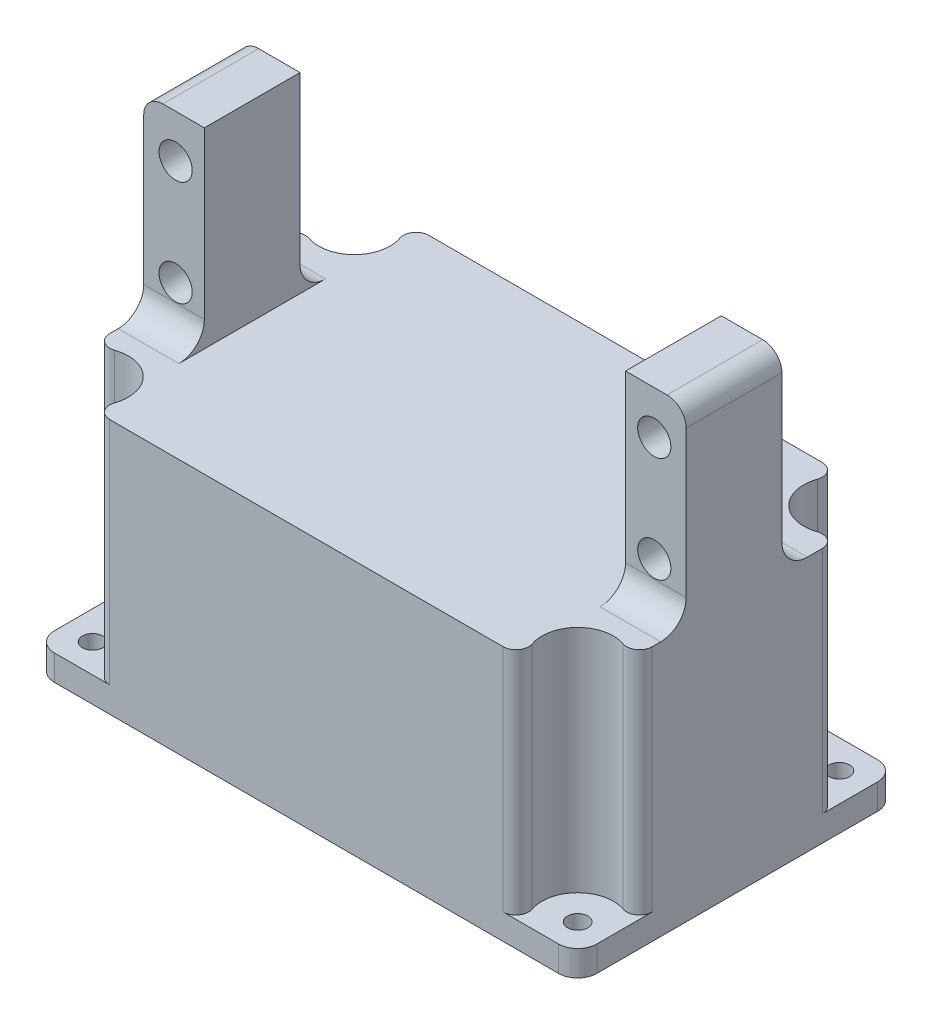
from build123d import *

# Parameters (mm, degrees)
EXTRUDE_1_DEPTH     = 40
SKETCH_2_W          = 9.5
SKETCH_2_H          = 30
EXTRUDE_2_DEPTH     = 15
SKETCH_3_R          = 2.6
CUT_EXTRUDE_1_DEPTH = 89.290712988
FILLET_1_R          = 3
FILLET_2_R          = 4
SKETCH_4_R          = 1.6
CUT_EXTRUDE_2_DEPTH = 64.492125496
CUT_EXTRUDE_3_DEPTH = 36
FILLET_3_R          = 2
SKETCH_7_R          = 5.6
CUT_EXTRUDE_4_DEPTH = 36
FILLET_4_R          = 2


with BuildPart() as part:
    # 草图1 → 凸台-拉伸1 (new body)
    with BuildSketch(Plane(origin=(0, 0, 0), x_dir=(1, 0, 0), z_dir=(0, 1, 0))):
        with BuildLine():
            Line((-39.5, -25), (39.5, -25))
            ThreePointArc((39.5, -25), (41.621320344, -24.121320344), (42.5, -22))
            Line((42.5, -22), (42.5, 22))
            ThreePointArc((42.5, 22), (41.621320344, 24.121320344), (39.5, 25))
            Line((39.5, 25), (-39.5, 25))
            ThreePointArc((-39.5, 25), (-41.621320344, 24.121320344), (-42.5, 22))
            Line((-42.5, 22), (-42.5, -22))
            ThreePointArc((-42.5, -22), (-41.621320344, -24.121320344), (-39.5, -25))
        make_face()
    extrude(amount=EXTRUDE_1_DEPTH)

    # 草图2 → 凸台-拉伸2 (add)
    with BuildSketch(Plane.XY.offset(-7)):
        with Locations((-37.75, 55)):
            Rectangle(SKETCH_2_W, SKETCH_2_H)
    extrude_2 = extrude(amount=EXTRUDE_2_DEPTH)

    # 镜向1: 凸台-拉伸2 across plane
    add(extrude_2.mirror(Plane(origin=(0, 0, 0), x_dir=(0, 0, 1), z_dir=(1, 0, 0))))

    # 草图3 → 切除-拉伸1 (cut, through all)
    with BuildSketch(Plane.XY.offset(8)):
        with Locations((37.5, 63.25)):
            Circle(SKETCH_3_R)
        with Locations((37.5, 46.75)):
            Circle(SKETCH_3_R)
        with Locations((-37.5, 63.25)):
            Circle(SKETCH_3_R)
        with Locations((-37.5, 46.75)):
            Circle(SKETCH_3_R)
    extrude(amount=-CUT_EXTRUDE_1_DEPTH, mode=Mode.SUBTRACT)

    # 圆角1
    fillet_1_edges = [part.edges().sort_by_distance(p)[0] for p in [
        (-42.5, 70, 0.5),
        (42.5, 70, 0.5),
    ]]
    fillet(fillet_1_edges, radius=FILLET_1_R)

    # 圆角2
    fillet_2_edges = [part.edges().sort_by_distance(p)[0] for p in [
        (-37.75, 40, -7),
        (-37.75, 40, 8),
        (37.75, 40, 8),
        (37.75, 40, -7),
    ]]
    fillet(fillet_2_edges, radius=FILLET_2_R)

    # 草图4 → 切除-拉伸2 (cut, through all)
    with BuildSketch(Plane(origin=(0, 40, 0), x_dir=(1, 0, 0), z_dir=(0, 1, 0))):
        with Locations(Location((-38, 20.5, 0), (0, 0, 270))):
            Circle(SKETCH_4_R)
        with Locations(Location((38, 20.5, 0), (0, 0, 270))):
            Circle(SKETCH_4_R)
        with Locations(Location((38, -20.5, 0), (0, 0, 270))):
            Circle(SKETCH_4_R)
        with Locations(Location((-38, -20.5, 0), (0, 0, 270))):
            Circle(SKETCH_4_R)
    extrude(amount=-CUT_EXTRUDE_2_DEPTH, mode=Mode.SUBTRACT)

    # 草图5 → 切除-拉伸3 (cut)
    with BuildSketch(Plane.XZ):
        with BuildLine():
            ThreePointArc((29.414547187, -20), (31.918881682, -14.418881682), (37.5, -11.914547187))
            Line((37.5, -11.914547187), (37.5, 11.914547187))
            ThreePointArc((37.5, 11.914547187), (31.918881682, 14.418881682), (29.414547187, 20))
            Line((29.414547187, 20), (-29.414547187, 20))
            ThreePointArc((-29.414547187, 20), (-31.918881682, 14.418881682), (-37.5, 11.914547187))
            Line((-37.5, 11.914547187), (-37.5, -11.914547187))
            ThreePointArc((-37.5, -11.914547187), (-31.918881682, -14.418881682), (-29.414547187, -20))
            Line((-29.414547187, -20), (29.414547187, -20))
        make_face()
    extrude(amount=-CUT_EXTRUDE_3_DEPTH, mode=Mode.SUBTRACT)

    # 圆角3
    fillet_3_edges = [part.edges().sort_by_distance(p)[0] for p in [
        (31.918881682, 36, -14.418881682),
        (-31.918881682, 36, -14.418881682),
        (-31.918881682, 36, 14.418881682),
        (31.918881682, 36, 14.418881682),
        (37.5, 36, 0),
        (37.5, 18, 11.914547187),
        (29.414547187, 18, 20),
        (0, 36, 20),
        (-29.414547187, 18, 20),
        (-37.5, 18, 11.914547187),
        (-37.5, 36, 0),
        (-37.5, 18, -11.914547187),
        (-29.414547187, 18, -20),
        (0, 36, -20),
        (29.414547187, 18, -20),
        (37.5, 18, -11.914547187),
    ]]
    fillet(fillet_3_edges, radius=FILLET_3_R)

    # 草图7 → 切除-拉伸4 (cut)
    with BuildSketch(Plane(origin=(0, 40, 0), x_dir=(1, 0, 0), z_dir=(0, 1, 0))):
        with Locations((-38, 20.5)):
            Circle(SKETCH_7_R)
        with Locations((38, 20.5)):
            Circle(SKETCH_7_R)
        with Locations((-38, -20.5)):
            Circle(SKETCH_7_R)
        with Locations((38, -20.5)):
            Circle(SKETCH_7_R)
    extrude(amount=-CUT_EXTRUDE_4_DEPTH, mode=Mode.SUBTRACT)

    # 圆角4
    fillet_4_edges = [part.edges().sort_by_distance(p)[0] for p in [
        (-34.666833338, 22, 25),
        (34.666833338, 22, 25),
        (-42.5, 22, -17.166833338),
        (34.666833338, 22, -25),
        (-34.666833338, 22, -25),
        (42.5, 22, -17.166833338),
        (42.5, 22, 17.166833338),
        (-42.5, 22, 17.166833338),
    ]]
    fillet(fillet_4_edges, radius=FILLET_4_R)


solid = part.part
